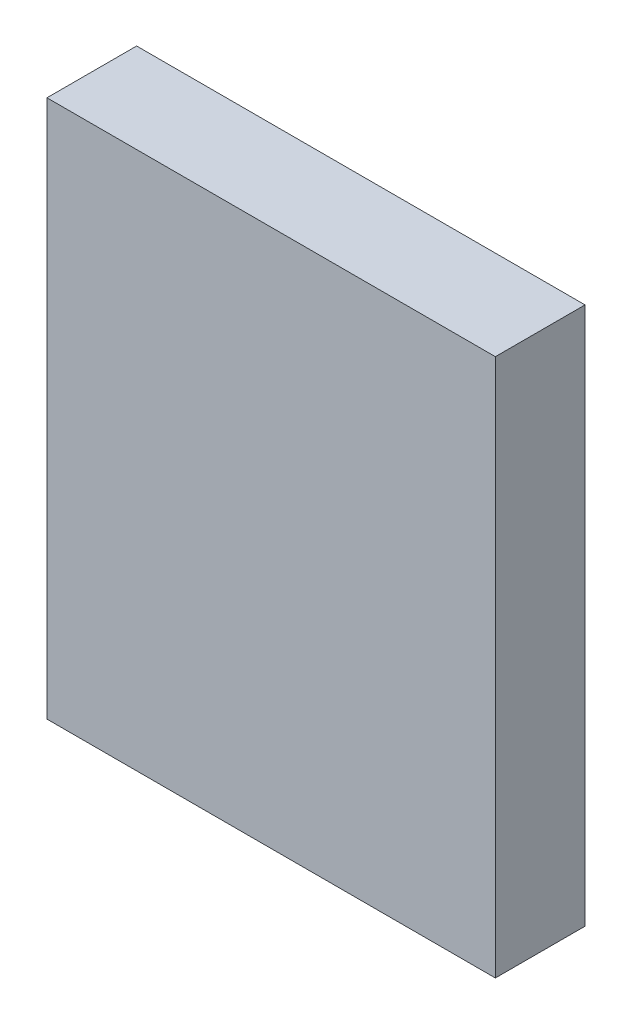
from build123d import *

# Parameters (mm, degrees)
SKETCH1_W           = 50
SKETCH1_H           = 60
BOSS_EXTRUDE1_DEPTH = 10


with BuildPart() as part:
    # Sketch1 → Boss-Extrude1 (new body)
    with BuildSketch(Plane.XY):
        with Locations((25, 30)):
            Rectangle(SKETCH1_W, SKETCH1_H)
    extrude(amount=BOSS_EXTRUDE1_DEPTH)


solid = part.part
